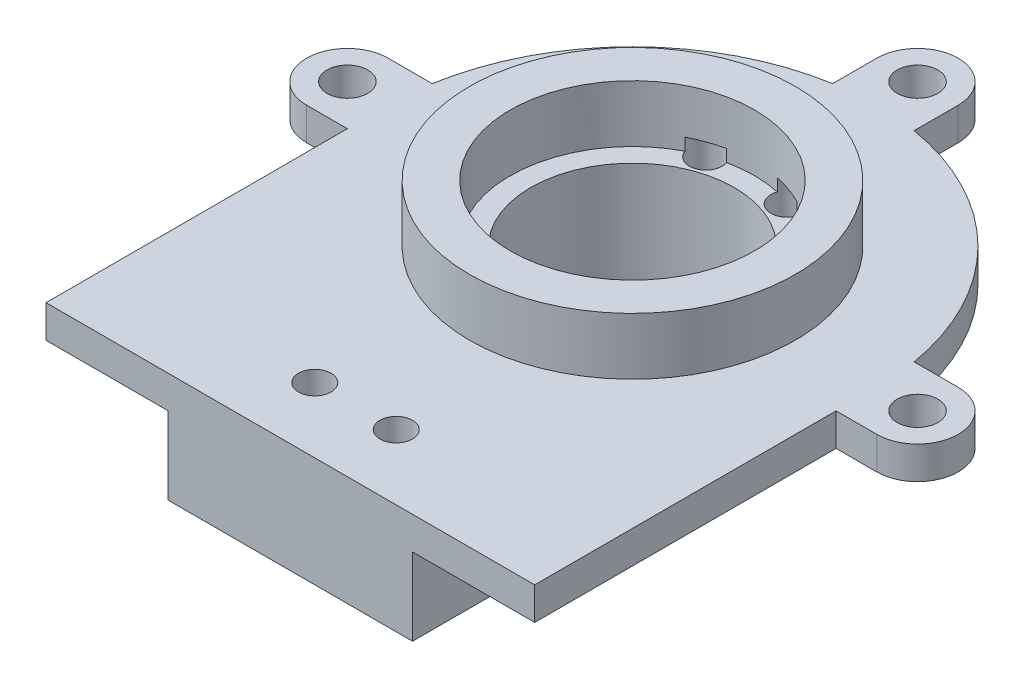
from build123d import *

# Parameters (mm, degrees)
SKETCH_1_R          = 20
SKETCH_1_R_2        = 15
EXTRUDE_1_DEPTH     = 7
SKETCH_2_R          = 70
SKETCH_2_R_2        = 12.5
EXTRUDE_2_DEPTH     = 4
SKETCH_3_W          = 30
SKETCH_3_H          = 64
SKETCH_3_R          = 2
SKETCH_3_R_2        = 12.5
EXTRUDE_3_DEPTH     = 9.5
SKETCH_4_R          = 81.168465046
CUT_EXTRUDE_1_DEPTH = 9.5
CUT_EXTRUDE_START   = -15
SKETCH_6_R          = 2
CUT_EXTRUDE_2_DEPTH = 15
SKETCH_7_R          = 2.5
EXTRUDE_4_DEPTH     = 4


with BuildPart() as part:
    # Эскиз1 → Бобышка-Вытянуть1 (new body)
    with BuildSketch(Plane(origin=(0, 0, 0), x_dir=(1, 0, 0), z_dir=(0, 1, 0))):
        with Locations(Location((0, 0, 0), (0, 0, 270))):
            Circle(SKETCH_1_R)
        with Locations(Location((0, 0, 0), (0, 0, 270))):
            Circle(SKETCH_1_R_2, mode=Mode.SUBTRACT)
    extrude(amount=EXTRUDE_1_DEPTH)

    # Эскиз2 → Бобышка-Вытянуть2 (add)
    with BuildSketch(Plane.XZ):
        with Locations(Location((0, 0, 0), (0, 0, 270))):
            Circle(SKETCH_2_R)
        with Locations(Location((0, 0, 0), (0, 0, 270))):
            Circle(SKETCH_2_R_2, mode=Mode.SUBTRACT)
    extrude(amount=EXTRUDE_2_DEPTH)

    # Эскиз3 → Бобышка-Вытянуть3 (add)
    with BuildSketch(Plane.XZ.offset(4)):
        with Locations((0, 10)):
            Rectangle(SKETCH_3_W, SKETCH_3_H)
        with Locations(Location((-5, 34, 0), (0, 0, 270))):
            Circle(SKETCH_3_R, mode=Mode.SUBTRACT)
        with Locations(Location((5, 34, 0), (0, 0, 270))):
            Circle(SKETCH_3_R, mode=Mode.SUBTRACT)
        with Locations(Location((-5, -14, 0), (0, 0, 270))):
            Circle(SKETCH_3_R, mode=Mode.SUBTRACT)
        with Locations(Location((5, -14, 0), (0, 0, 270))):
            Circle(SKETCH_3_R, mode=Mode.SUBTRACT)
        with Locations(Location((0, 0, 0), (0, 0, 270))):
            Circle(SKETCH_3_R_2, mode=Mode.SUBTRACT)
    extrude(amount=EXTRUDE_3_DEPTH)

    # Эскиз4 → Вырез-Вытянуть1 (cut)
    with BuildSketch(Plane(origin=(0, 0, 0), x_dir=(1, 0, 0), z_dir=(0, 1, 0))):
        Circle(SKETCH_4_R)
        with BuildLine():
            Line((-30, 0), (-30, -42))
            Line((-30, -42), (30, -42))
            Line((30, -42), (30, 0))
            ThreePointArc((30, 0), (0, 30), (-30, 0))
        make_face(mode=Mode.SUBTRACT)
    extrude(amount=-CUT_EXTRUDE_1_DEPTH, mode=Mode.SUBTRACT)

    # Эскиз6 → Вырез-Вытянуть2 (cut)
    with BuildSketch(Plane.XZ.offset(13.5).offset(CUT_EXTRUDE_START)):
        with Locations(Location((-5, 34, 0), (0, 0, 270))):
            Circle(SKETCH_6_R)
        with Locations(Location((5, 34, 0), (0, 0, 270))):
            Circle(SKETCH_6_R)
        with Locations(Location((-5, -14, 0), (0, 0, 160.346175942))):
            Circle(SKETCH_6_R)
        with Locations(Location((5, -14, 0), (0, 0, 19.653824058))):
            Circle(SKETCH_6_R)
    extrude(amount=CUT_EXTRUDE_2_DEPTH, mode=Mode.SUBTRACT)

    # Эскиз7 → Бобышка-Вытянуть4 (add)
    # profile 1 of 3: a face of its own
    with BuildSketch(Plane(origin=(0, 0, 0), x_dir=(1, 0, 0), z_dir=(0, 1, 0))):
        with BuildLine():
            Line((-35, 5), (-27, 5))
            Line((-27, 5), (-27, -5))
            Line((-27, -5), (-35, -5))
            ThreePointArc((-35, -5), (-40, 0), (-35, 5))
        make_face()
        with Locations(Location((-35, 0, 0), (0, 0, 270))):
            Circle(SKETCH_7_R, mode=Mode.SUBTRACT)
    # profile 2 of 3: a face of its own
    with BuildSketch(Plane(origin=(0, 0, 0), x_dir=(1, 0, 0), z_dir=(0, 1, 0))):
        with BuildLine():
            Line((-5, 35), (-5, 27))
            Line((-5, 27), (5, 27))
            Line((5, 27), (5, 35))
            ThreePointArc((5, 35), (0, 40), (-5, 35))
        make_face()
        with Locations(Location((0, 35, 0), (0, 0, 270))):
            Circle(SKETCH_7_R, mode=Mode.SUBTRACT)
    # profile 3 of 3: a face of its own
    with BuildSketch(Plane(origin=(0, 0, 0), x_dir=(1, 0, 0), z_dir=(0, 1, 0))):
        with BuildLine():
            Line((35, 5), (27, 5))
            Line((27, 5), (27, -5))
            Line((27, -5), (35, -5))
            ThreePointArc((35, -5), (40, 0), (35, 5))
        make_face()
        with Locations(Location((35, 0, 0), (0, 0, 270))):
            Circle(SKETCH_7_R, mode=Mode.SUBTRACT)
    extrude(amount=-EXTRUDE_4_DEPTH)


solid = part.part
